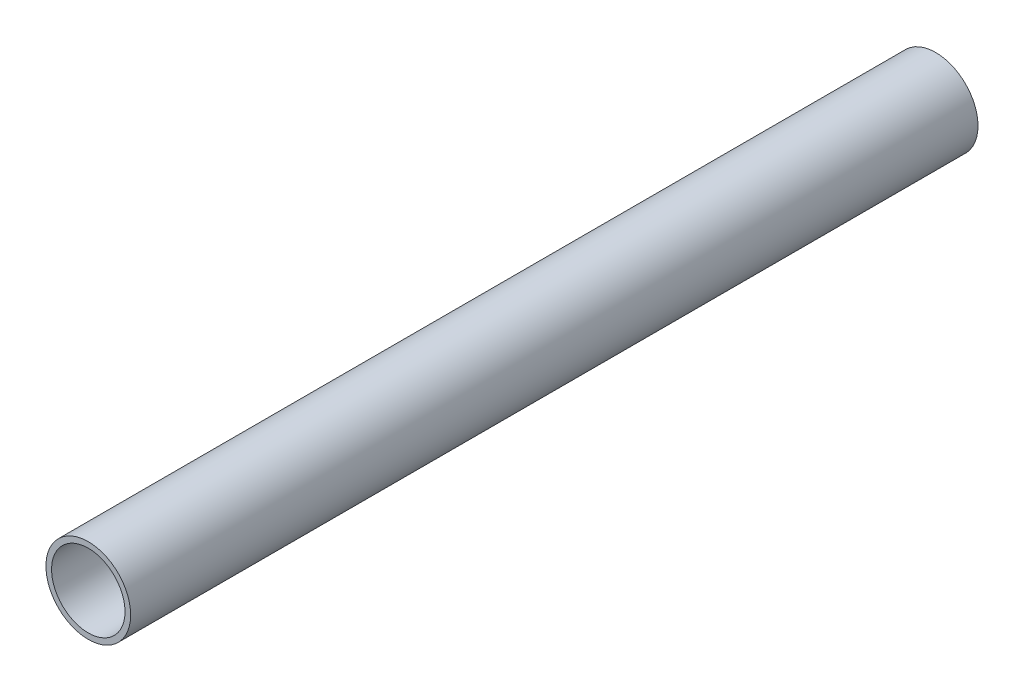
from build123d import *

# Parameters (mm, degrees)
SKETCH1_R           = 7.5
SKETCH1_R_2         = 6.5
BOSS_EXTRUDE1_DEPTH = 150


with BuildPart() as part:
    # Sketch1 → Boss-Extrude1 (new body)
    with BuildSketch(Plane.XY):
        with Locations((-123, -48)):
            Circle(SKETCH1_R)
        with Locations((-123, -48)):
            Circle(SKETCH1_R_2, mode=Mode.SUBTRACT)
    extrude(amount=BOSS_EXTRUDE1_DEPTH)


solid = part.part
